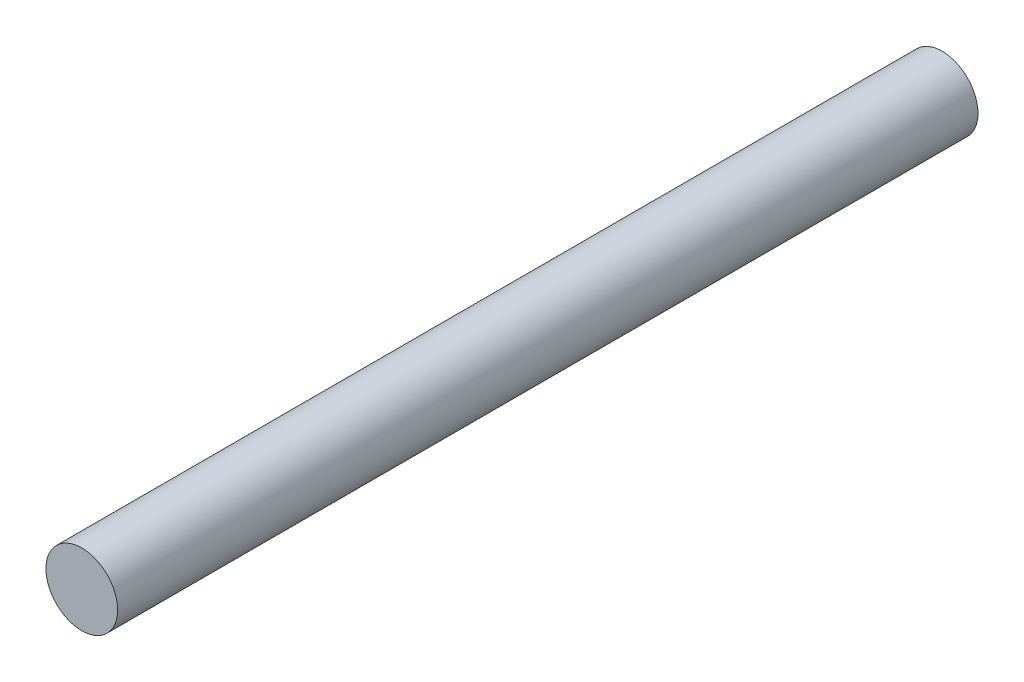
from build123d import *

# Parameters (mm, degrees)
SKETCH2_R           = 3
BOSS_EXTRUDE1_DEPTH = 72


with BuildPart() as part:
    # Sketch2 → Boss-Extrude1 (new body)
    with BuildSketch(Plane(origin=(0, 0, 0), x_dir=(0, 1, 0), z_dir=(0, 0, 1))):
        with Locations(Location((0, 0, 0), (0, 0, 270))):
            Circle(SKETCH2_R)
    extrude(amount=BOSS_EXTRUDE1_DEPTH)


solid = part.part
